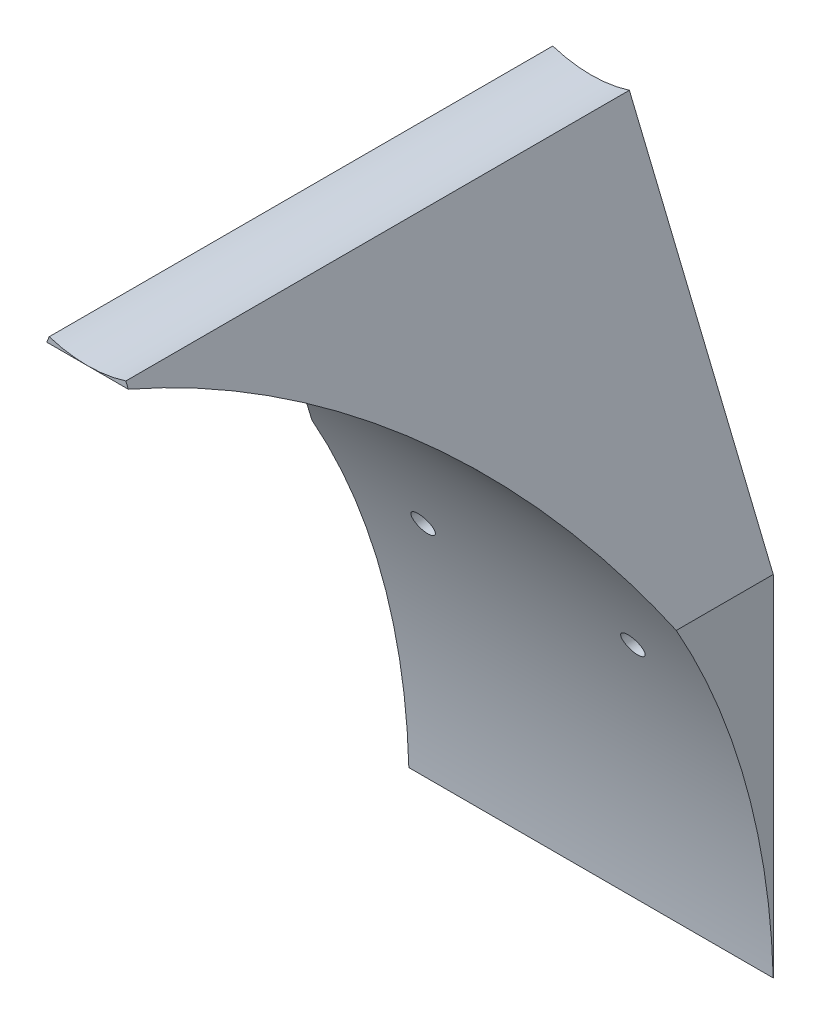
from build123d import *

# Parameters (mm, degrees)
BOSS_EXTRUDE1_DEPTH  = 76.2
CUT_EXTRUDE1_START   = -27.572978
CUT_EXTRUDE1_DEPTH   = 55.145956
M3_CLEARANCE_HOLE1_D = 3.4
CUT_EXTRUDE2_REACH   = 149.802
SKETCH10_R           = 19.05


with BuildPart() as part:
    # Sketch1 → Boss-Extrude1 (new body)
    with BuildSketch(Plane.XY):
        Polygon((27.572977546, -123.606903324), (27.572977546, -70.715393761), (0, -4.148337413), (-27.572977546, -70.715393761), (-27.572977546, -123.606903324), align=None)
    extrude(amount=BOSS_EXTRUDE1_DEPTH)

    # Sketch2 → Cut-Extrude1 (cut)
    with BuildSketch(Plane(origin=(0, 0, 0), x_dir=(0, 0, -1), z_dir=(1, 0, 0)).offset(CUT_EXTRUDE1_START)):
        with BuildLine():
            Line((-76.2, -123.606903324), (0, -123.606903324))
            ThreePointArc((0, -123.606903324), (-21.882740068, -59.509478763), (-76.2, -19.05))
            Line((-76.2, -19.05), (-76.2, -70.715393761))
            Line((-76.2, -70.715393761), (-76.2, -123.606903324))
        make_face()
    extrude(amount=CUT_EXTRUDE1_DEPTH, mode=Mode.SUBTRACT)

    # M3 Clearance Hole1 (through all)
    with Locations(Plane(origin=(0, 0, 0), x_dir=(-1, 0, 0), z_dir=(0, 0, -1))):
        with Locations((-15.875, -81.009177721), (15.875, -81.009177721), (0, -38.1)):
            Hole(M3_CLEARANCE_HOLE1_D / 2)

    # Sketch10 → Cut-Extrude2 (cut, up to next)
    with BuildSketch(Plane(origin=(0, 0, 0), x_dir=(-1, 0, 0), z_dir=(0, 0, -1)), mode=Mode.PRIVATE) as cut_extrude2_sk1:
        Circle(SKETCH10_R)
    cut_extrude2_tool1 = extrude(cut_extrude2_sk1.sketch, amount=-CUT_EXTRUDE2_REACH, mode=Mode.PRIVATE) & part.part
    add(cut_extrude2_tool1.solids().sort_by_distance((0, 0, 0))[0], mode=Mode.SUBTRACT)


solid = part.part
